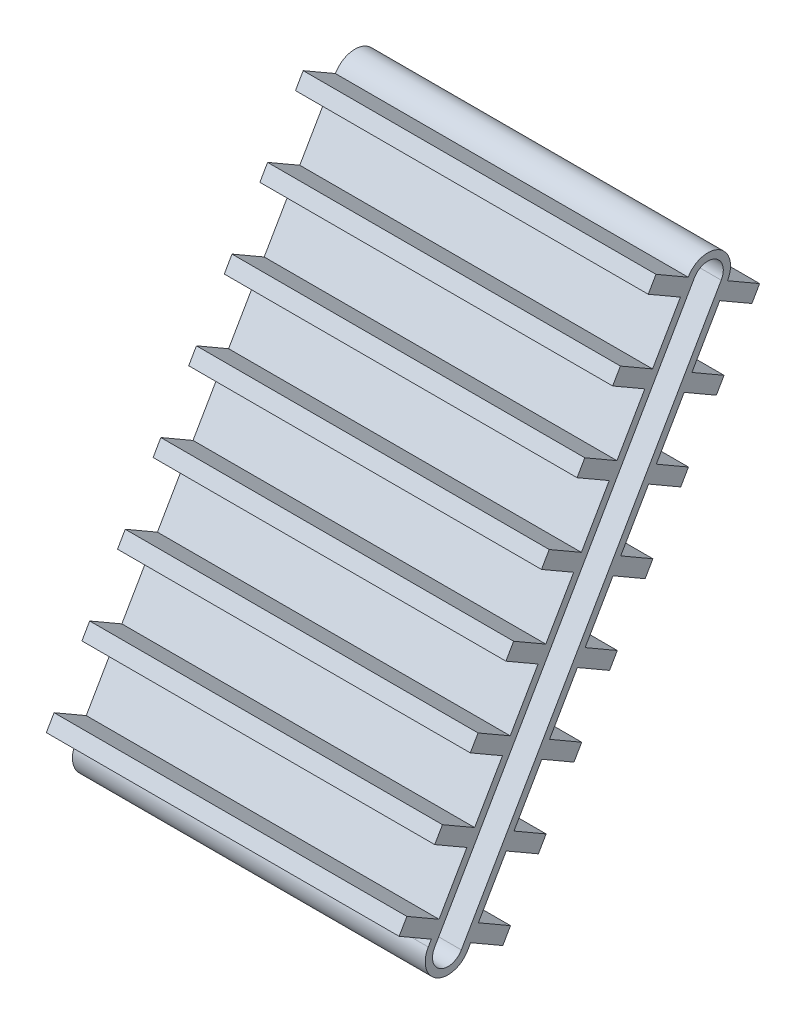
from build123d import *

# Parameters (mm, degrees)
BOSS_EXTRUDE1_DEPTH = 1140
SKETCH2_W           = 1140
SKETCH2_H           = 50
BOSS_EXTRUDE2_DEPTH = 120
LPATTERN1_COUNT     = 8
LPATTERN1_PITCH     = 230
SKETCH3_W           = 1140
SKETCH3_H           = 50
BOSS_EXTRUDE3_DEPTH = 120
LPATTERN2_COUNT     = 8
LPATTERN2_PITCH     = 230


with BuildPart() as part:
    # Sketch1 → Boss-Extrude1 (new body)
    with BuildSketch(Plane(origin=(0, 0, 0), x_dir=(0, 0, -1), z_dir=(1, 0, 0))):
        with BuildLine():
            Line((-903.311007421, -1417.780559889), (-63.566264638, 36.7))
            ThreePointArc((-63.566264638, 36.7), (36.7, 63.566264638), (63.566264638, -36.7))
            Line((63.566264638, -36.7), (-776.178478145, -1491.180559889))
            ThreePointArc((-776.178478145, -1491.180559889), (-876.444742783, -1518.046824527), (-903.311007421, -1417.780559889))
        make_face()
        with BuildLine():
            Line((-883.046012972, -1429.480559889), (-43.301270189, 25))
            ThreePointArc((-43.301270189, 25), (25, 43.301270189), (43.301270189, -25))
            Line((43.301270189, -25), (-796.443472594, -1479.480559889))
            ThreePointArc((-796.443472594, -1479.480559889), (-864.744742783, -1497.781830078), (-883.046012972, -1429.480559889))
        make_face(mode=Mode.SUBTRACT)
    extrude(amount=BOSS_EXTRUDE1_DEPTH)

    # Sketch2 → Boss-Extrude2 (add)
    with BuildSketch(Plane(origin=(0, 36.7, 63.566264638), x_dir=(1, 0, 0), z_dir=(0, 0.5000000000000019, 0.8660254037844376))):
        with Locations((570, -25)):
            Rectangle(SKETCH2_W, SKETCH2_H)
    boss_extrude2 = extrude(amount=BOSS_EXTRUDE2_DEPTH)

    # LPattern1: Boss-Extrude2 ×8
    with Locations(*[Vector(0, -0.8660254037844402, 0.4999999999999975) * (i * LPATTERN1_PITCH) for i in range(1, LPATTERN1_COUNT)]):
        add(boss_extrude2)

    # Sketch3 → Boss-Extrude3 (add)
    with BuildSketch(Plane(origin=(0, -36.7, -63.566264638), x_dir=(-1, 0, 0), z_dir=(0, -0.49999999999999756, -0.86602540378444))):
        with Locations((-570, -25)):
            Rectangle(SKETCH3_W, SKETCH3_H)
    boss_extrude3 = extrude(amount=BOSS_EXTRUDE3_DEPTH)

    # LPattern2: Boss-Extrude3 ×8
    with Locations(*[Vector(0, -0.8660254037844458, 0.49999999999998757) * (i * LPATTERN2_PITCH) for i in range(1, LPATTERN2_COUNT)]):
        add(boss_extrude3)


solid = part.part
